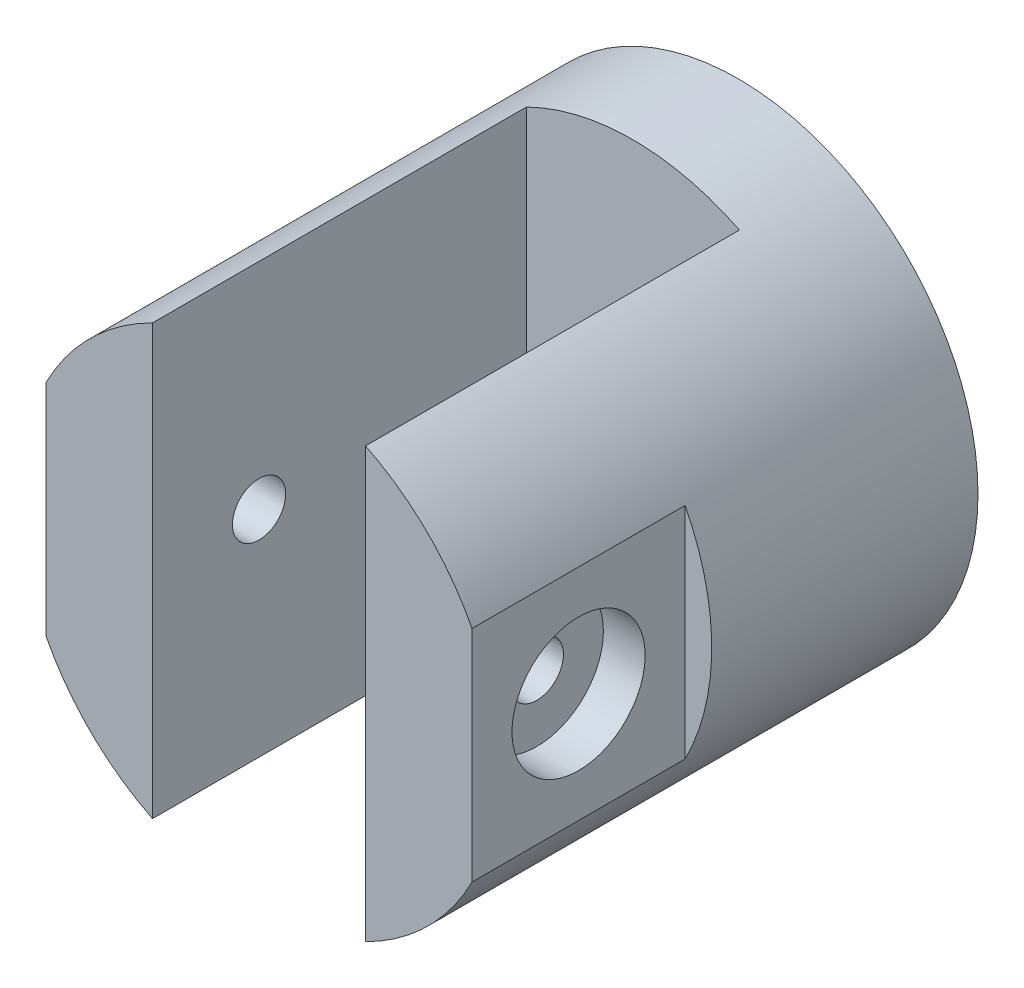
from build123d import *

# Parameters (mm, degrees)
SKETCH1_R                = 28.575
OD_DON_T_CARE_DEPTH      = 57.15
SKETCH3_W                = 25.4
SKETCH3_H                = 44.577
SLOT_DEPTH               = 50.8
SKETCH4_R                = 7.9375
F_5_8_THROUGH_HOLE_DEPTH = 61.167850045
SKETCH5_OUTSIDE_W        = 78.948
SKETCH5_OUTSIDE_H        = 78.948
SKETCH5_OUTSIDE_W_2      = 53.975
SKETCH5_OUTSIDE_H_2      = 51.195336702
FLAT_SURFACE_DEPTH       = 25.4
SKETCH2_R                = 3.175
F_1_4_THROUGH_HOLE_DEPTH = 84.641818189
SKETCH6_R                = 7.9375
CUT_EXTRUDE1_DEPTH       = 4.9784
CUT_EXTRUDE2_DEPTH       = 70.994169563
CUT_EXTRUDE2_DEPTH_BACK  = 25.4
CUT_EXTRUDE3_START       = -4.9784
SKETCH8_R                = 7.9375
CUT_EXTRUDE3_DEPTH       = 4.9784


with BuildPart() as part:
    # Sketch1 → OD Don't Care (new body)
    with BuildSketch(Plane.XY):
        Circle(SKETCH1_R)
    extrude(amount=OD_DON_T_CARE_DEPTH)

    # Sketch3 → Slot (cut, symmetric)
    with BuildSketch(Plane(origin=(0, 0, 0), x_dir=(1, 0, 0), z_dir=(0, 1, 0))):
        with Locations((0, -34.8615)):
            Rectangle(SKETCH3_W, SKETCH3_H)
    extrude(amount=SLOT_DEPTH, both=True, mode=Mode.SUBTRACT)

    # Sketch4 → 5/8" Through Hole (cut, through all)
    with BuildSketch(Plane.XY.offset(12.573)):
        Circle(SKETCH4_R)
    extrude(amount=-F_5_8_THROUGH_HOLE_DEPTH, mode=Mode.SUBTRACT)

    # Sketch5 outside → Flat Surface (cut)
    with BuildSketch(Plane.XY.offset(57.15)):
        Rectangle(SKETCH5_OUTSIDE_W, SKETCH5_OUTSIDE_H)
        with Locations((-1.5875, 0)):
            Rectangle(SKETCH5_OUTSIDE_W_2, SKETCH5_OUTSIDE_H_2, mode=Mode.SUBTRACT)
    extrude(amount=-FLAT_SURFACE_DEPTH, mode=Mode.SUBTRACT)

    # Sketch2 → 1/4" Through Hole (cut, through all)
    with BuildSketch(Plane(origin=(25.4, 0, 0), x_dir=(0, 0, -1), z_dir=(1, 0, 0))):
        with Locations((-44.45, 0)):
            Circle(SKETCH2_R)
    extrude(amount=-F_1_4_THROUGH_HOLE_DEPTH, mode=Mode.SUBTRACT)

    # Sketch6 → Cut-Extrude1 (cut)
    with BuildSketch(Plane(origin=(25.4, 0, 0), x_dir=(0, 0, -1), z_dir=(1, 0, 0))):
        with Locations((-44.45, 0)):
            Circle(SKETCH6_R)
    extrude(amount=-CUT_EXTRUDE1_DEPTH, mode=Mode.SUBTRACT)

    # Sketch7 → Cut-Extrude2 (cut, two sides: drawn at the far end of the back side and taken through both)
    with BuildSketch(Plane.XY.offset(57.15).offset(-CUT_EXTRUDE2_DEPTH_BACK)):
        Polygon((-25.4, -159.463065209), (-25.4, -13.090860361), (-25.4, 13.090860361), (-25.4, 159.463065209), (-318.144409696, 159.463065209), (-318.144409696, -159.463065209), align=None)
    extrude(amount=CUT_EXTRUDE2_DEPTH + CUT_EXTRUDE2_DEPTH_BACK, mode=Mode.SUBTRACT)

    # Sketch8 → Cut-Extrude3 (cut)
    with BuildSketch(Plane.ZY.offset(25.4).offset(CUT_EXTRUDE3_START)):
        with Locations(Location((44.45, 0, 0), (0, 0, 180))):
            Circle(SKETCH8_R)
    extrude(amount=CUT_EXTRUDE3_DEPTH, mode=Mode.SUBTRACT)


solid = part.part
